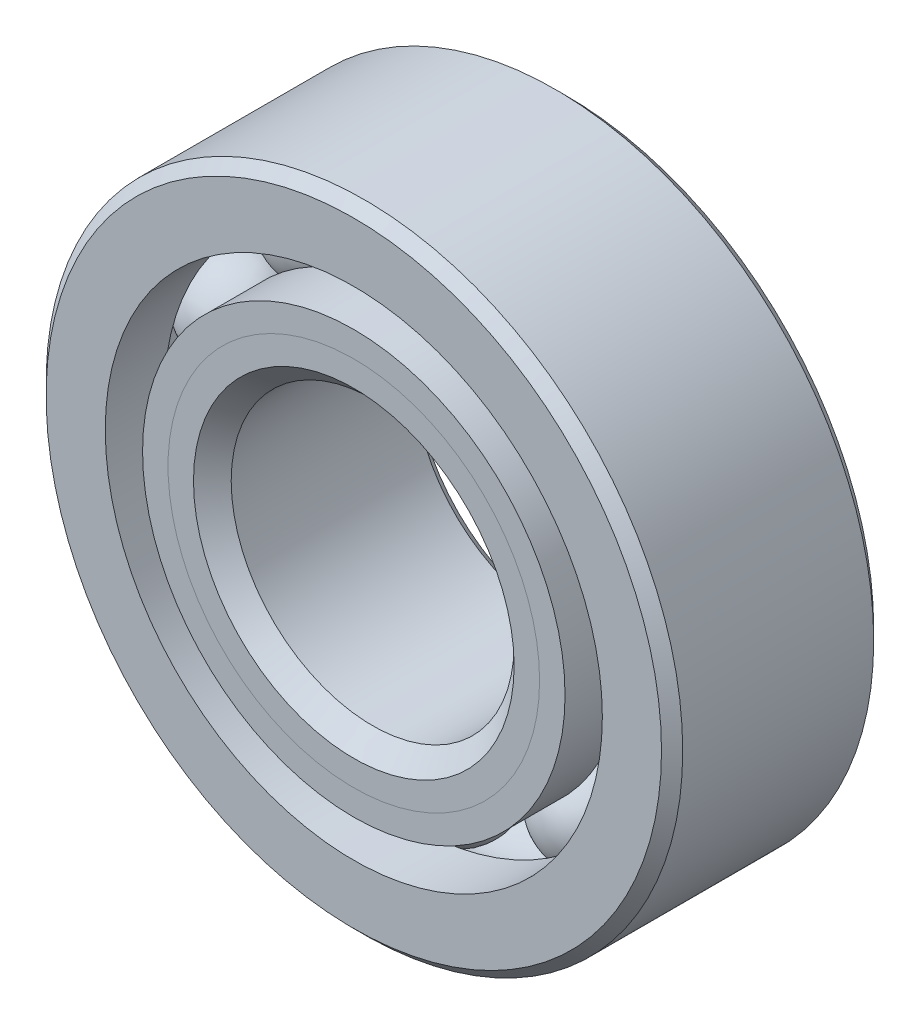
from build123d import *

# Parameters (mm, degrees)
CIRPATTERN1_COUNT = 10


with BuildPart() as part:
    # Sketch1 → Revolve1 (revolve)
    with BuildSketch(Plane(origin=(0, 0, 0), x_dir=(0, 0, -1), z_dir=(1, 0, 0))):
        with BuildLine():
            Line((4.28625, 14.2875), (-4.28625, 14.2875))
            Line((-4.28625, 14.2875), (-4.7625, 13.81125))
            Line((-4.7625, 13.81125), (-4.7625, 11.156112637))
            Line((-4.7625, 11.156112637), (-2.116666667, 11.156112637))
            ThreePointArc((-2.116666667, 11.156112637), (0, 12.595030731), (2.116666667, 11.156112637))
            Line((2.116666667, 11.156112637), (4.7625, 11.156112637))
            Line((4.7625, 11.156112637), (4.7625, 13.81125))
            Line((4.7625, 13.81125), (4.28625, 14.2875))
        make_face()
    revolve(axis=Axis((0, 0, 4.7625), (0, 0, -1)))


with BuildPart() as body_2:
    # Sketch2 → Revolve2 (revolve)
    with BuildSketch(Plane(origin=(0, 0, 0), x_dir=(0, 0, -1), z_dir=(1, 0, 0))):
        with BuildLine():
            Line((-4.7625, 9.481387363), (-2.116666667, 9.481387363))
            ThreePointArc((-2.116666667, 9.481387363), (-1.279722925, 8.436261434), (0, 8.042469269))
            Line((0, 8.042469269), (0, 7.196234635))
            Line((0, 7.196234635), (-3.619923636, 7.196234635))
            Line((-3.619923636, 7.196234635), (-4.7625, 8.338810999))
            Line((-4.7625, 8.338810999), (-4.7625, 9.481387363))
        make_face()
    revolve(axis=Axis((0, 0, 4.7625), (0, 0, -1)))


with BuildPart() as body_3:
    # Sketch3 → Revolve3 (revolve)
    with BuildSketch(Plane(origin=(0, 0, 0), x_dir=(0, 0, -1), z_dir=(1, 0, 0))):
        with BuildLine():
            Line((-4.7625, 8.338810999), (-3.619923636, 7.196234635))
            Line((-3.619923636, 7.196234635), (0, 7.196234635))
            Line((0, 7.196234635), (0, 8.042469269))
            ThreePointArc((0, 8.042469269), (1.279722925, 8.436261434), (2.116666667, 9.481387363))
            Line((2.116666667, 9.481387363), (4.7625, 9.481387363))
            Line((4.7625, 9.481387363), (4.7625, 6.82625))
            Line((4.7625, 6.82625), (4.28625, 6.35))
            Line((4.28625, 6.35), (-3.916265365, 6.35))
            Line((-3.916265365, 6.35), (-4.7625, 7.196234635))
            Line((-4.7625, 7.196234635), (-4.7625, 8.338810999))
        make_face()
    revolve(axis=Axis((0, 0, 4.7625), (0, 0, -1)))


with BuildPart() as body_4:
    # Sketch4 → Revolve4 (revolve)
    with BuildSketch(Plane(origin=(0, 0, 0), x_dir=(0, 0, -1), z_dir=(1, 0, 0))):
        with BuildLine():
            Line((-2.276280731, 10.31875), (2.276280731, 10.31875))
            ThreePointArc((2.276280731, 10.31875), (0, 12.595030731), (-2.276280731, 10.31875))
        make_face()
    revolve(axis=Axis((0, 10.31875, 2.276280731), (0, 0, -1)))


with BuildPart() as cirpattern1_1:
    # CirPattern1: pattern copy
    add(body_4.part.rotate(Axis((0, 0, -4.7625), (0, 0, 1)), 1 * 360 / CIRPATTERN1_COUNT))


with BuildPart() as cirpattern1_2:
    # CirPattern1: pattern copy
    add(body_4.part.rotate(Axis((0, 0, -4.7625), (0, 0, 1)), 2 * 360 / CIRPATTERN1_COUNT))


with BuildPart() as cirpattern1_3:
    # CirPattern1: pattern copy
    add(body_4.part.rotate(Axis((0, 0, -4.7625), (0, 0, 1)), 3 * 360 / CIRPATTERN1_COUNT))


with BuildPart() as cirpattern1_4:
    # CirPattern1: pattern copy
    add(body_4.part.rotate(Axis((0, 0, -4.7625), (0, 0, 1)), 4 * 360 / CIRPATTERN1_COUNT))


with BuildPart() as cirpattern1_5:
    # CirPattern1: pattern copy
    add(body_4.part.rotate(Axis((0, 0, -4.7625), (0, 0, 1)), 5 * 360 / CIRPATTERN1_COUNT))


with BuildPart() as cirpattern1_6:
    # CirPattern1: pattern copy
    add(body_4.part.rotate(Axis((0, 0, -4.7625), (0, 0, 1)), 6 * 360 / CIRPATTERN1_COUNT))


with BuildPart() as cirpattern1_7:
    # CirPattern1: pattern copy
    add(body_4.part.rotate(Axis((0, 0, -4.7625), (0, 0, 1)), 7 * 360 / CIRPATTERN1_COUNT))


with BuildPart() as cirpattern1_8:
    # CirPattern1: pattern copy
    add(body_4.part.rotate(Axis((0, 0, -4.7625), (0, 0, 1)), 8 * 360 / CIRPATTERN1_COUNT))


with BuildPart() as cirpattern1_9:
    # CirPattern1: pattern copy
    add(body_4.part.rotate(Axis((0, 0, -4.7625), (0, 0, 1)), 9 * 360 / CIRPATTERN1_COUNT))


solid = Compound([part.part, body_2.part, body_3.part, body_4.part, cirpattern1_1.part, cirpattern1_2.part, cirpattern1_3.part, cirpattern1_4.part, cirpattern1_5.part, cirpattern1_6.part, cirpattern1_7.part, cirpattern1_8.part, cirpattern1_9.part])
